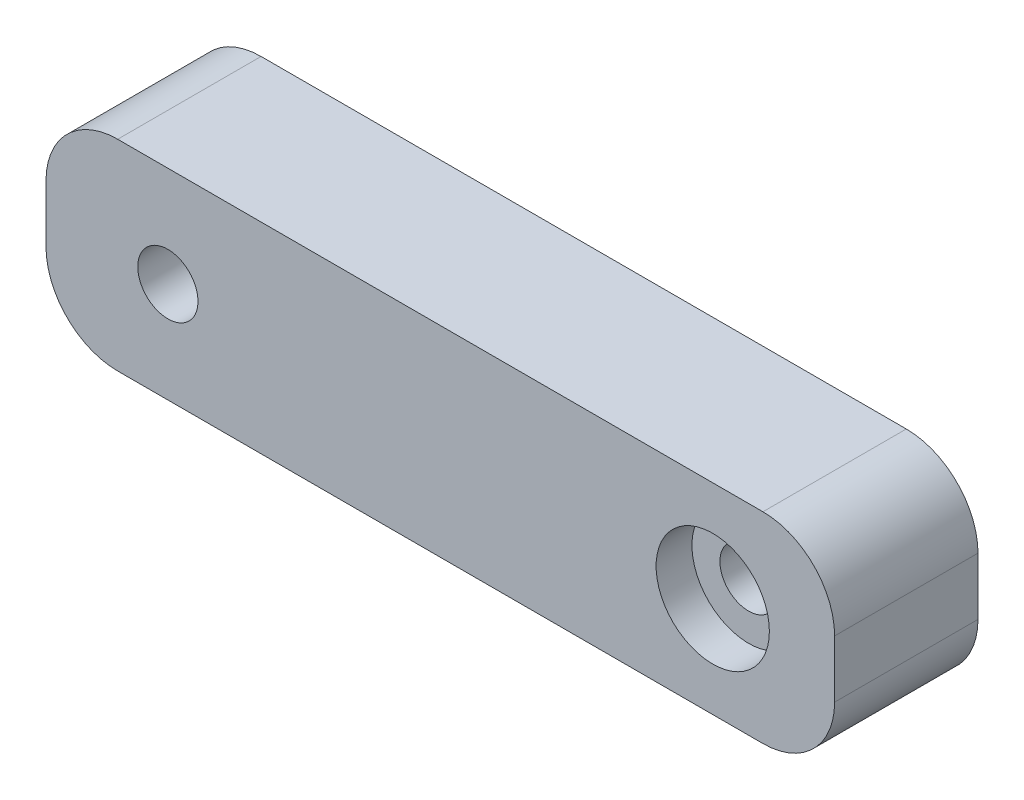
from build123d import *

# Parameters (mm, degrees)
SKETCH1_W           = 55
SKETCH1_H           = 14
BOSS_EXTRUDE1_DEPTH = 10
FILLET1_R           = 5
FILLET2_R           = 5
SKETCH2_R           = 4
CUT_EXTRUDE2_DEPTH  = 2.5
SKETCH3_R           = 2.1
CUT_EXTRUDE3_DEPTH  = 2
SKETCH4_R           = 3.95
CUT_EXTRUDE4_DEPTH  = 5
CUT_EXTRUDE5_REACH  = 64.926
SKETCH5_R           = 2
SKETCH7_R           = 2.1
CUT_EXTRUDE6_DEPTH  = 63.967570185
BOSS_EXTRUDE2_START = 2.5
SKETCH9_R           = 3.95
SKETCH9_R_2         = 2
BOSS_EXTRUDE2_DEPTH = 2.5
CUT_EXTRUDE7_START  = -3
SKETCH10_R          = 2
CUT_EXTRUDE7_DEPTH  = 3


with BuildPart() as part:
    # Sketch1 → Boss-Extrude1 (new body)
    with BuildSketch(Plane.XY):
        with Locations((-31.850618243, 13.301945946)):
            Rectangle(SKETCH1_W, SKETCH1_H)
    extrude(amount=BOSS_EXTRUDE1_DEPTH)

    # Fillet1
    fillet1_edges = [part.edges().sort_by_distance(p)[0] for p in [
        (-59.350618243, 20.301945946, 5),
    ]]
    fillet(fillet1_edges, radius=FILLET1_R)

    # Fillet2
    fillet2_edges = [part.edges().sort_by_distance(p)[0] for p in [
        (-4.350618243, 20.301945946, 5),
        (-4.350618243, 6.301945946, 5),
        (-59.350618243, 6.301945946, 5),
    ]]
    fillet(fillet2_edges, radius=FILLET2_R)

    # Sketch2 → Cut-Extrude2 (cut)
    with BuildSketch(Plane(origin=(0, 0, 0), x_dir=(-1, 0, 0), z_dir=(0, 0, -1))):
        with Locations((50.850618243, 13.301945946)):
            Circle(SKETCH2_R)
    extrude(amount=-CUT_EXTRUDE2_DEPTH, mode=Mode.SUBTRACT)

    # Sketch3 → Cut-Extrude3 (cut)
    with BuildSketch(Plane(origin=(0, 0, 2.5), x_dir=(-1, 0, 0), z_dir=(0, 0, -1))):
        with Locations((50.850618243, 13.301945946)):
            Circle(SKETCH3_R)
    extrude(amount=-CUT_EXTRUDE3_DEPTH, mode=Mode.SUBTRACT)

    # Sketch4 → Cut-Extrude4 (cut)
    with BuildSketch(Plane.XY.offset(10)):
        with Locations((-12.850618243, 13.301945946)):
            Circle(SKETCH4_R)
    extrude(amount=-CUT_EXTRUDE4_DEPTH, mode=Mode.SUBTRACT)

    # Sketch5 → Cut-Extrude5 (cut, up to next)
    with BuildSketch(Plane.XY.offset(5), mode=Mode.PRIVATE) as cut_extrude5_sk1:
        with Locations((-12.850618243, 13.301945946)):
            Circle(SKETCH5_R)
    cut_extrude5_tool1 = extrude(cut_extrude5_sk1.sketch, amount=-CUT_EXTRUDE5_REACH, mode=Mode.PRIVATE) & part.part
    add(cut_extrude5_tool1.solids().sort_by_distance((-12.850618, 13.301946, 5))[0], mode=Mode.SUBTRACT)

    # Sketch7 → Cut-Extrude6 (cut, through all)
    with BuildSketch(Plane(origin=(0, 0, 4.5), x_dir=(-1, 0, 0), z_dir=(0, 0, -1))):
        with Locations((50.850618243, 13.301945946)):
            Circle(SKETCH7_R)
    extrude(amount=-CUT_EXTRUDE6_DEPTH, mode=Mode.SUBTRACT)

    # Sketch9 → Boss-Extrude2 (add)
    with BuildSketch(Plane.XY.offset(5).offset(BOSS_EXTRUDE2_START)):
        with Locations((-12.850618243, 13.301945946)):
            Circle(SKETCH9_R)
        with Locations((-12.850618243, 13.301945946)):
            Circle(SKETCH9_R_2, mode=Mode.SUBTRACT)
    extrude(amount=-BOSS_EXTRUDE2_DEPTH)

    # Sketch10 → Cut-Extrude7 (cut)
    with BuildSketch(Plane(origin=(0, 0, 0), x_dir=(-1, 0, 0), z_dir=(0, 0, -1)).offset(CUT_EXTRUDE7_START)):
        Polygon((12.850618243, 17.34339783), (9.350618243, 15.322671888), (9.350618243, 11.281220004), (12.850618243, 9.260494062), (16.350618243, 11.281220004), (16.350618243, 15.322671888), align=None)
        with Locations(Location((12.850618243, 13.301945946, 0), (0, 0, 180))):
            Circle(SKETCH10_R, mode=Mode.SUBTRACT)
    extrude(amount=CUT_EXTRUDE7_DEPTH, mode=Mode.SUBTRACT)


solid = part.part
